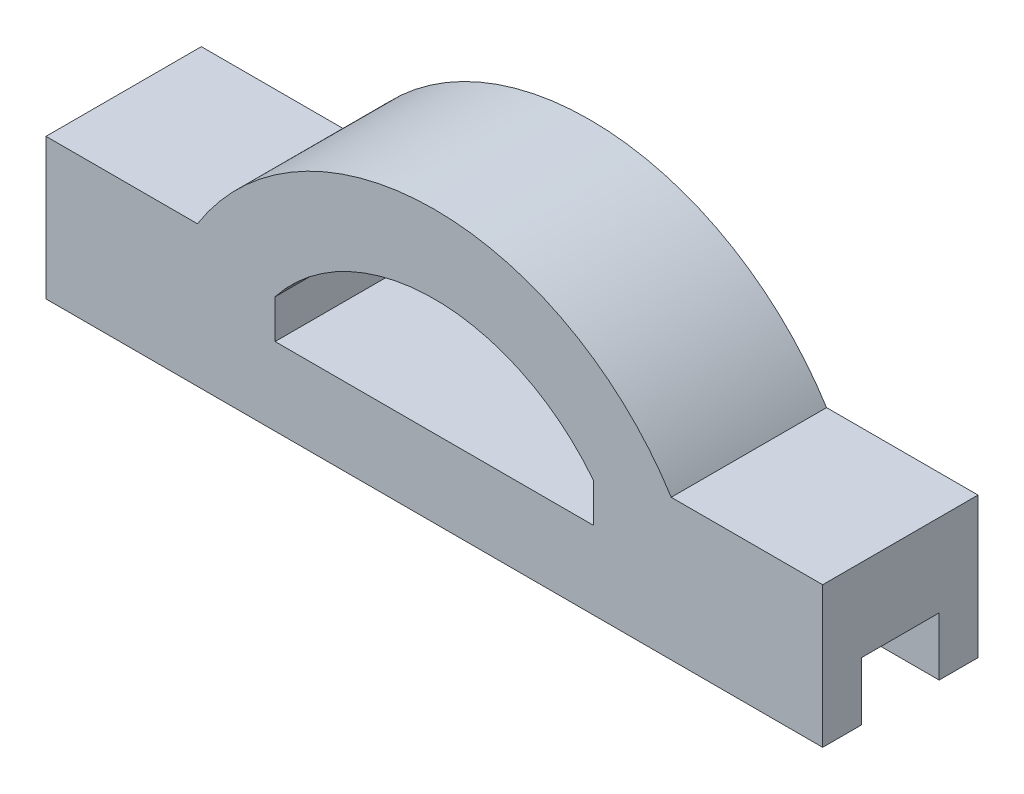
from build123d import *

# Parameters (mm, degrees)
BOSS_EXTRUDE1_DEPTH      = 2
BOSS_EXTRUDE1_DEPTH_BACK = 2
SKETCH2_W                = 2
SKETCH2_H                = 1.5
CUT_EXTRUDE1_DEPTH       = 2


with BuildPart() as part:
    # Sketch1 → Boss-Extrude1 (new, two sides: drawn at the far end of the back side and taken through both)
    with BuildSketch(Plane.XY.offset(-BOSS_EXTRUDE1_DEPTH_BACK)):
        with BuildLine():
            Line((0, 0), (20, 0))
            Line((20, 0), (20, 3.627122207))
            Line((20, 3.627122207), (16.1, 3.627122207))
            ThreePointArc((16.1, 3.627122207), (10, 7), (3.9, 3.627122207))
            Line((3.9, 3.627122207), (0, 3.627122207))
            Line((0, 3.627122207), (0, 2))
            Line((0, 2), (0, 0))
        make_face()
        with BuildLine():
            Line((5.9, 2), (5.9, 3))
            ThreePointArc((5.9, 3), (10, 5), (14.1, 3))
            Line((14.1, 3), (14.1, 2))
            Line((14.1, 2), (5.9, 2))
        make_face(mode=Mode.SUBTRACT)
    extrude(amount=BOSS_EXTRUDE1_DEPTH + BOSS_EXTRUDE1_DEPTH_BACK)

    # Sketch2 → Cut-Extrude1 (cut)
    with BuildSketch(Plane.ZY):
        with Locations((0, 0.75)):
            Rectangle(SKETCH2_W, SKETCH2_H)
    cut_extrude1 = extrude(amount=-CUT_EXTRUDE1_DEPTH, mode=Mode.SUBTRACT)

    # Mirror1: Cut-Extrude1 across plane
    add(cut_extrude1.mirror(Plane.ZY.offset(-10)), mode=Mode.SUBTRACT)


solid = part.part
